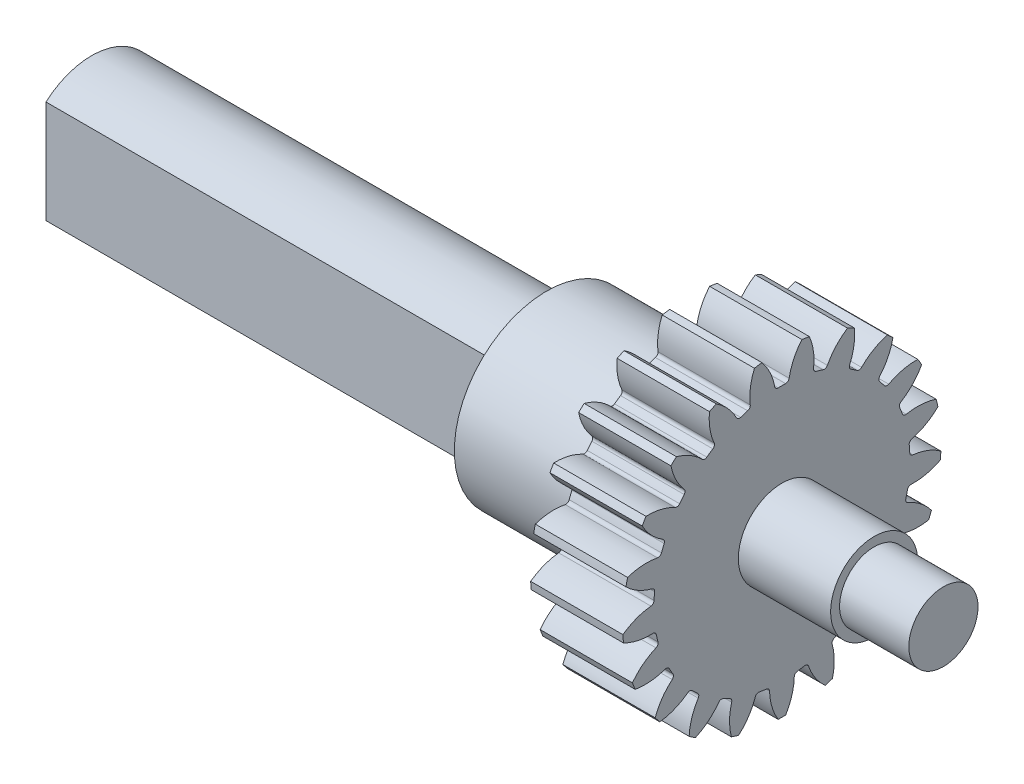
from build123d import *

# Parameters (mm, degrees)
BASPROSKE_W                = 2
BASPROSKE_H                = 3.45
TOOTHCUT_DEPTH             = 6.273044661
ROOTFILLETS_R              = 0.076
TEETHCUTS_COUNT            = 21
ROOTFILLETS_OF_TEETHCUTS_R = 0.076
AXIS_DEPTH                 = 12.96
AXIS2SKE_R                 = 0.9445
AXIS2_DEPTH                = 2
AXIS3SKE_R                 = 0.75
AXIS3_DEPTH                = 1.5
PADSKE_R                   = 2
PAD_DEPTH                  = 3.1


with BuildPart() as part:
    # BasProSke → Base-Revolve (revolve)
    with BuildSketch(Plane(origin=(0, 0, 0), x_dir=(1, 0, 0), z_dir=(0, 1, 0)), mode=Mode.PRIVATE) as base_revolve_sk:
        with Locations((1, 1.725)):
            Rectangle(BASPROSKE_W, BASPROSKE_H)
    revolve(base_revolve_sk.sketch.rotate(Axis((-10, 0, 0), (1, 0, 0)), 180), axis=Axis((-10, 0, 0), (1, 0, 0)))

    # TooCutSke → ToothCut (cut, through all)
    with BuildSketch(Plane(origin=(0, 0, 0), x_dir=(0, 0, -1), z_dir=(1, 0, 0))):
        with BuildLine():
            ThreePointArc((0.146331163, 2.770137757), (0, 2.774), (-0.146331163, 2.770137757))
            ThreePointArc((-0.146331163, 2.770137757), (-0.248855145, 3.131030422), (-0.453094785, 3.445737987))
            ThreePointArc((-0.453094785, 3.445737987), (0, 3.4754), (0.453094785, 3.445737987))
            ThreePointArc((0.453094785, 3.445737987), (0.248855145, 3.131030422), (0.146331163, 2.770137757))
        make_face()
    toothcut = extrude(amount=TOOTHCUT_DEPTH, mode=Mode.SUBTRACT)

    # RootFillets
    rootfillets_edges = [part.edges().sort_by_distance(p)[0] for p in [
        (1, 2.770137757, -0.146331163),
        (1, 2.770137757, 0.146331163),
    ]]
    fillet(rootfillets_edges, radius=ROOTFILLETS_R)

    # TeethCuts: ToothCut ×21 about axis
    teethcuts_axis = Axis((0, 0, 0), (1, 0, 0))
    for i in range(1, TEETHCUTS_COUNT):
        add(toothcut.rotate(teethcuts_axis, i * 360 / TEETHCUTS_COUNT), mode=Mode.SUBTRACT)

    # RootFillets of TeethCuts
    rootfillets_of_teethcuts_edges = [part.edges().sort_by_distance(p)[0] for p in [
        (1, 2.690200176, 0.676682357),
        (1, 2.603936441, 0.956342518),
        (1, 2.371226504, 1.439569681),
        (1, 2.206363945, 1.681378643),
        (1, 1.841558951, 2.074544921),
        (1, 1.612746331, 2.257016897),
        (1, 1.148260804, 2.525187741),
        (1, 0.875829127, 2.632109295),
        (1, 0.352934646, 2.751456548),
        (1, 0.061090662, 2.773327231),
        (1, -0.473751305, 2.733246367),
        (1, -0.759075976, 2.668122872),
        (1, -1.258342373, 2.472175251),
        (1, -1.511795383, 2.325844088),
        (1, -1.9311242, 1.991440515),
        (1, -2.130185136, 1.776903849),
        (1, -2.432317166, 1.33375755),
        (1, -2.559298591, 1.070077905),
        (1, -2.717388078, 0.557564374),
        (1, -2.761007135, 0.268170844),
        (1, -2.761007135, -0.268170844),
        (1, -2.717388078, -0.557564374),
        (1, -2.559298591, -1.070077905),
        (1, -2.432317166, -1.33375755),
        (1, -2.130185136, -1.776903849),
        (1, -1.9311242, -1.991440515),
        (1, -1.511795383, -2.325844088),
        (1, -1.258342373, -2.472175251),
        (1, -0.759075976, -2.668122872),
        (1, -0.473751305, -2.733246367),
        (1, 0.061090662, -2.773327231),
        (1, 0.352934646, -2.751456548),
        (1, 0.875829127, -2.632109295),
        (1, 1.148260804, -2.525187741),
        (1, 1.612746331, -2.257016897),
        (1, 1.841558951, -2.074544921),
        (1, 2.206363945, -1.681378643),
        (1, 2.371226504, -1.439569681),
        (1, 2.603936441, -0.956342518),
        (1, 2.690200176, -0.676682357),
    ]]
    fillet(rootfillets_of_teethcuts_edges, radius=ROOTFILLETS_OF_TEETHCUTS_R)

    # AxisSke → Axis (add)
    with BuildSketch(Plane.ZY):
        with BuildLine():
            Line((0.99, 1.113552873), (0.99, -1.113552873))
            ThreePointArc((0.99, -1.113552873), (-1.49, 0), (0.99, 1.113552873))
        make_face()
    extrude(amount=AXIS_DEPTH)

    # Axis2Ske → Axis2 (add)
    with BuildSketch(Plane(origin=(2, 0, 0), x_dir=(0, 0, -1), z_dir=(1, 0, 0))):
        with Locations(Location((0, 0, 0), (0, 0, 180))):
            Circle(AXIS2SKE_R)
    extrude(amount=AXIS2_DEPTH)

    # Axis3Ske → Axis3 (add)
    with BuildSketch(Plane(origin=(4, 0, 0), x_dir=(0, 0, -1), z_dir=(1, 0, 0))):
        Circle(AXIS3SKE_R)
    extrude(amount=AXIS3_DEPTH)

    # PadSke → Pad (add)
    with BuildSketch(Plane.ZY):
        with Locations(Location((0, 0, 0), (0, 0, 180))):
            Circle(PADSKE_R)
    extrude(amount=PAD_DEPTH)


solid = part.part
